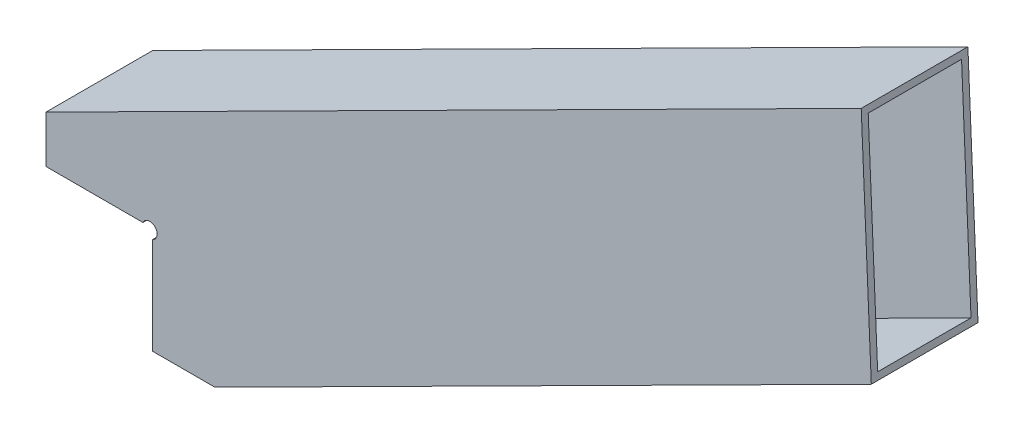
from build123d import *

# Parameters (mm, degrees)
BOSS_EXTRUDE1_DEPTH = 25.4
SHELL1_T            = -1.5875
SKETCH2_R           = 1.771315789
CUT_EXTRUDE1_DEPTH  = 224.468749705


with BuildPart() as part:
    # Sketch1 → Boss-Extrude1 (new body)
    with BuildSketch(Plane.XY):
        Polygon((171.8384328, 137.597905652), (-22.225, 39.800277228), (-22.225, 28.575), (3.175, 28.575), (3.175, 3.175), (17.979241427, 3.175), (174.241035508, 81.922616972), align=None)
    extrude(amount=BOSS_EXTRUDE1_DEPTH)

    # Shell1
    shell1_openings = [part.faces().sort_by_distance(p)[0] for p in [
        (10.577120713, 3.175, 12.7),
        (3.175, 15.875, 12.7),
        (-9.525, 28.575, 12.7),
        (-22.225, 34.187638614, 12.7),
        (173.039734154, 109.760261312, 12.7),
    ]]
    offset(amount=SHELL1_T, openings=shell1_openings, kind=Kind.INTERSECTION)

    # Sketch2 → Cut-Extrude1 (cut, through all)
    with BuildSketch(Plane.XY.offset(25.4)):
        with Locations((2.461305961, 27.861305961)):
            Circle(SKETCH2_R)
    extrude(amount=-CUT_EXTRUDE1_DEPTH, mode=Mode.SUBTRACT)


solid = part.part
